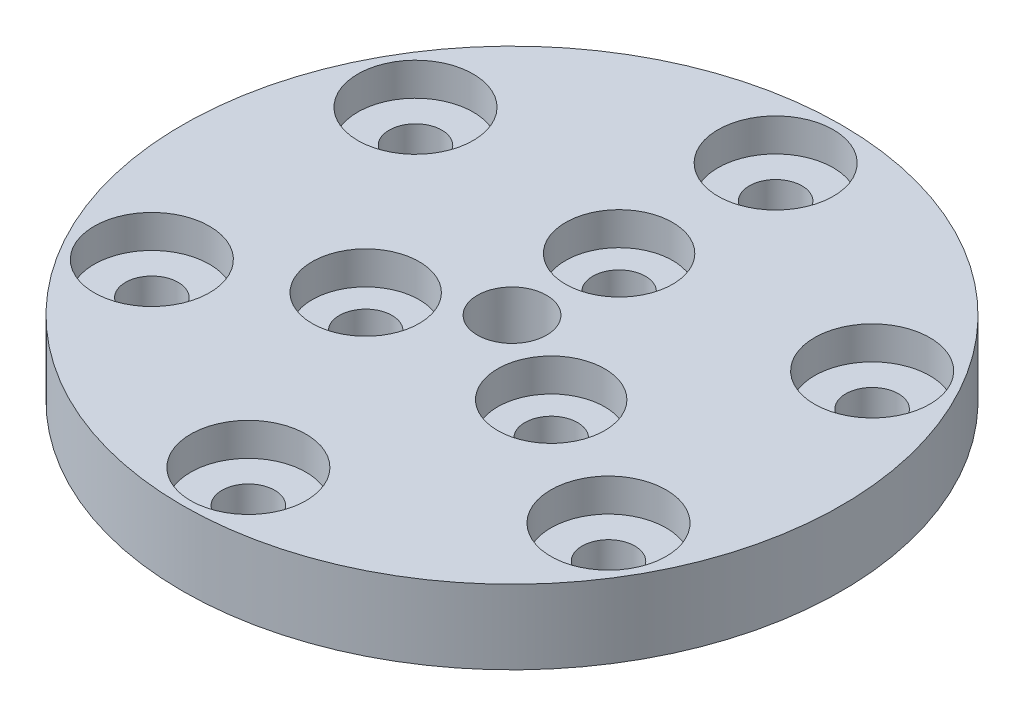
from build123d import *

# Parameters (mm, degrees)
SKETCH1_R           = 20
SKETCH1_R_2         = 2.1
BOSS_EXTRUDE1_DEPTH = 4.5
SKETCH2_R           = 1.6
CUT_EXTRUDE1_DEPTH  = 29.640006983
SKETCH5_R           = 3.5
CUT_EXTRUDE4_DEPTH  = 2
CIRPATTERN1_COUNT   = 6
SKETCH3_R           = 1.6
CUT_EXTRUDE2_DEPTH  = 29.640006983
SKETCH4_R           = 3.25
CUT_EXTRUDE3_DEPTH  = 2
CIRPATTERN2_COUNT   = 3


with BuildPart() as part:
    # Sketch1 → Boss-Extrude1 (new body)
    with BuildSketch(Plane(origin=(0, 0, 0), x_dir=(1, 0, 0), z_dir=(0, 1, 0))):
        with Locations(Location((0, 0, 0), (0, 0, 90))):
            Circle(SKETCH1_R)
        with Locations(Location((0, 0, 0), (0, 0, 90))):
            Circle(SKETCH1_R_2, mode=Mode.SUBTRACT)
    extrude(amount=BOSS_EXTRUDE1_DEPTH)

    # Sketch2 → Cut-Extrude1 (cut, through all)
    with BuildSketch(Plane.XZ):
        with Locations(Location((0, 16, 0), (0, 0, 270))):
            Circle(SKETCH2_R)
    cut_extrude1 = extrude(amount=-CUT_EXTRUDE1_DEPTH, mode=Mode.SUBTRACT)

    # Sketch5 → Cut-Extrude4 (cut)
    with BuildSketch(Plane(origin=(0, 4.5, 0), x_dir=(1, 0, 0), z_dir=(0, 1, 0))):
        with Locations(Location((0, -16, 0), (0, 0, 270))):
            Circle(SKETCH5_R)
    cut_extrude4 = extrude(amount=-CUT_EXTRUDE4_DEPTH, mode=Mode.SUBTRACT)

    # CirPattern1: Cut-Extrude1, Cut-Extrude4 ×6 about axis
    cirpattern1_axis = Axis((0, 0, 0), (0, 1, 0))
    add([cut_extrude1.rotate(cirpattern1_axis, i * 360 / CIRPATTERN1_COUNT) for i in range(1, CIRPATTERN1_COUNT)], mode=Mode.SUBTRACT)
    add([cut_extrude4.rotate(cirpattern1_axis, i * 360 / CIRPATTERN1_COUNT) for i in range(1, CIRPATTERN1_COUNT)], mode=Mode.SUBTRACT)

    # Sketch3 → Cut-Extrude2 (cut, through all)
    with BuildSketch(Plane(origin=(0, 4.5, 0), x_dir=(1, 0, 0), z_dir=(0, 1, 0))):
        with Locations(Location((0, 6.5, 0), (0, 0, 270))):
            Circle(SKETCH3_R)
    cut_extrude2 = extrude(amount=-CUT_EXTRUDE2_DEPTH, mode=Mode.SUBTRACT)

    # Sketch4 → Cut-Extrude3 (cut)
    with BuildSketch(Plane(origin=(0, 4.5, 0), x_dir=(1, 0, 0), z_dir=(0, 1, 0))):
        with Locations(Location((0, 6.5, 0), (0, 0, 270))):
            Circle(SKETCH4_R)
    cut_extrude3 = extrude(amount=-CUT_EXTRUDE3_DEPTH, mode=Mode.SUBTRACT)

    # CirPattern2: Cut-Extrude2, Cut-Extrude3 ×3 about axis
    cirpattern2_axis = Axis((0, 0, 0), (0, 1, 0))
    add([cut_extrude2.rotate(cirpattern2_axis, i * 360 / CIRPATTERN2_COUNT) for i in range(1, CIRPATTERN2_COUNT)], mode=Mode.SUBTRACT)
    add([cut_extrude3.rotate(cirpattern2_axis, i * 360 / CIRPATTERN2_COUNT) for i in range(1, CIRPATTERN2_COUNT)], mode=Mode.SUBTRACT)


solid = part.part
